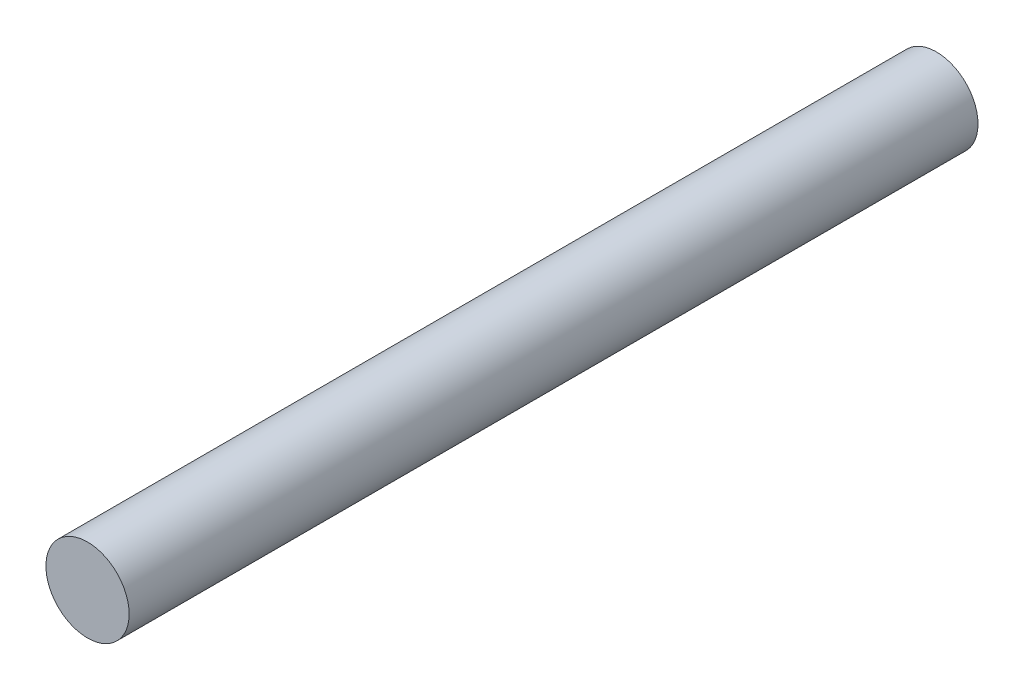
from build123d import *

# Parameters (mm, degrees)
SKETCH1_R           = 6.223
BOSS_EXTRUDE1_DEPTH = 127


with BuildPart() as part:
    # Sketch1 → Boss-Extrude1 (new body)
    with BuildSketch(Plane(origin=(0, 0, 0), x_dir=(0, 1, 0), z_dir=(0, 0, 1))):
        with Locations(Location((0, 0, 0), (0, 0, 270))):
            Circle(SKETCH1_R)
    extrude(amount=BOSS_EXTRUDE1_DEPTH)


solid = part.part
